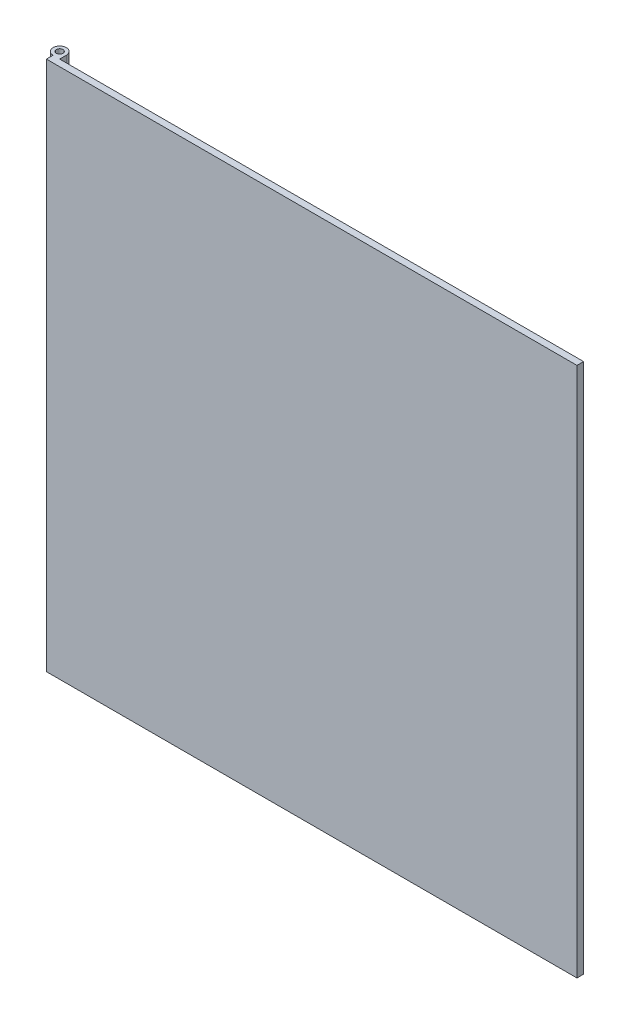
from build123d import *

# Parameters (mm, degrees)
ESQUISSE1_W        = 80
ESQUISSE1_H        = 80
BOSS_EXTRU_1_DEPTH = 1
ESQUISSE2_R        = 0.5
BOSS_EXTRU_2_DEPTH = 80


with BuildPart() as part:
    # Esquisse1 → Boss.-Extru.1 (new body)
    with BuildSketch(Plane.XY):
        with Locations((40, 40)):
            Rectangle(ESQUISSE1_W, ESQUISSE1_H)
    extrude(amount=BOSS_EXTRU_1_DEPTH)

    # Esquisse2 → Boss.-Extru.2 (add)
    with BuildSketch(Plane(origin=(0, 80, 0), x_dir=(1, 0, 0), z_dir=(0, 1, 0))):
        with BuildLine():
            Line((1, 0), (1, 1))
            ThreePointArc((1, 1), (-0.707106781, 1.707106781), (0, 0))
            Line((0, 0), (1, 0))
        make_face()
        with Locations(Location((0, 1, 0), (0, 0, 270))):
            Circle(ESQUISSE2_R, mode=Mode.SUBTRACT)
    extrude(amount=-BOSS_EXTRU_2_DEPTH)


solid = part.part
